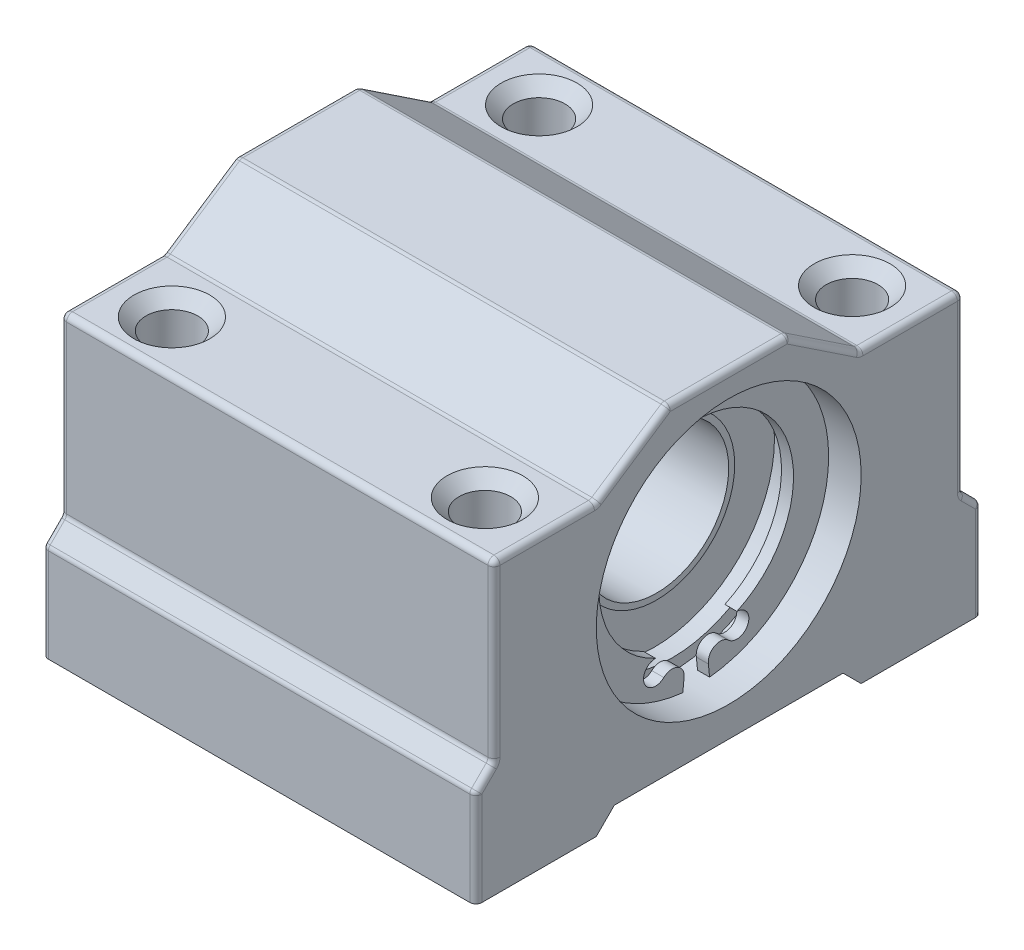
from build123d import *

# Parameters (mm, degrees)
SKETCH1_R           = 11
BOSS_EXTRUDE1_DEPTH = 36
EXTRUDE_THIN1_START = 0.5
SKETCH1_4_R         = 6.5
SKETCH1_4_R_2       = 6
EXTRUDE_THIN1_DEPTH = 29.5
BOSS_EXTRUDE2_START = 0.8
SKETCH1_5_R         = 10
SKETCH1_5_R_2       = 6
BOSS_EXTRUDE2_DEPTH = 29
BOSS_EXTRUDE3_START = 0.3
SKETCH1_6_R         = 11
SKETCH1_6_R_2       = 10
BOSS_EXTRUDE3_DEPTH = 31
BOSS_EXTRUDE4_START = 1
BOSS_EXTRUDE4_DEPTH = 1
FILLET1_R           = 0.5
SKETCH4_R           = 2.15
CUT_EXTRUDE3_DEPTH  = 51.209560914
CHAMFER1_SIZE       = 1


with BuildPart() as part:
    # Sketch1 → Boss-Extrude1 (new body)
    with BuildSketch(Plane(origin=(0, 0, 0), x_dir=(0, 0, -1), z_dir=(1, 0, 0))):
        Polygon((-21, -15), (-11, -15), (-9.5, -13.5), (9.5, -13.5), (11, -15), (21, -15), (21, -7), (19.5, -5.5), (19.5, 9), (11, 9), (5, 13), (-5, 13), (-11, 9), (-19.5, 9), (-19.5, -5.5), (-21, -7), align=None)
        Circle(SKETCH1_R, mode=Mode.SUBTRACT)
    extrude(amount=BOSS_EXTRUDE1_DEPTH)



with BuildPart() as body_2:
    # Sketch1<4> → Extrude-Thin1 (new body)
    with BuildSketch(Plane(origin=(0, 0, 0), x_dir=(0, 0, -1), z_dir=(1, 0, 0)).offset(EXTRUDE_THIN1_START)):
        Circle(SKETCH1_4_R)
        Circle(SKETCH1_4_R_2, mode=Mode.SUBTRACT)
    extrude(amount=EXTRUDE_THIN1_DEPTH)

    # Sketch1<5> → Boss-Extrude2 (add)
    with BuildSketch(Plane(origin=(0, 0, 0), x_dir=(0, 0, -1), z_dir=(1, 0, 0)).offset(BOSS_EXTRUDE2_START)):
        Circle(SKETCH1_5_R)
        Circle(SKETCH1_5_R_2, mode=Mode.SUBTRACT)
    extrude(amount=BOSS_EXTRUDE2_DEPTH)


with BuildPart() as part_1:
    add(part.part)

    add(body_2.part)  # Boss-Extrude3 merges body 2
    # Sketch1<6> → Boss-Extrude3 (add)
    with BuildSketch(Plane(origin=(0, 0, 0), x_dir=(0, 0, -1), z_dir=(1, 0, 0)).offset(BOSS_EXTRUDE3_START)):
        Circle(SKETCH1_6_R)
        Circle(SKETCH1_6_R_2, mode=Mode.SUBTRACT)
    extrude(amount=BOSS_EXTRUDE3_DEPTH)

    # Sketch3 → Boss-Extrude4 (add)
    with BuildSketch(Plane(origin=(31.3, 0, 0), x_dir=(0, 0, -1), z_dir=(1, 0, 0)).offset(BOSS_EXTRUDE4_START)):
        with BuildLine():
            Line((-1.011429614, -9.94871902), (-1.112572576, -10.943590922))
            ThreePointArc((-1.112572576, -10.943590922), (0, 11), (1.112572576, -10.943590922))
            Line((1.112572576, -10.943590922), (1.011429614, -9.94871902))
            ThreePointArc((1.011429614, -9.94871902), (1.535872296, -8.912190675), (2.686623353, -9.070945649))
            ThreePointArc((2.686623353, -9.070945649), (4.301522401, -8.715825098), (3.378506843, -7.343946161))
            ThreePointArc((3.378506843, -7.343946161), (0, 8.083801933), (-3.378506843, -7.343946161))
            ThreePointArc((-3.378506843, -7.343946161), (-4.301522401, -8.715825098), (-2.686623353, -9.070945649))
            ThreePointArc((-2.686623353, -9.070945649), (-1.535872296, -8.912190675), (-1.011429614, -9.94871902))
        make_face()
    extrude(amount=BOSS_EXTRUDE4_DEPTH)

    # Fillet1
    fillet1_edges = [part_1.edges().sort_by_distance(p)[0] for p in [
        (18, -5.5, -19.5),
        (18, -5.5, 19.5),
        (18, -7, 21),
        (18, -7, -21),
        (18, 9, -11),
        (18, 9, 11),
        (18, 13, 5),
        (18, 13, -5),
        (18, 9, -19.5),
        (18, 9, 19.5),
        (36, 11, -8),
        (36, 11, 8),
        (36, 1.75, 19.5),
        (0, -6.25, 20.25),
        (0, 11, 8),
        (36, -6.25, -20.25),
        (36, -11, -21),
        (36, 1.75, -19.5),
        (36, 13, 0),
        (36, 9, -15.25),
        (36, 9, 15.25),
        (36, -6.25, 20.25),
        (36, -11, 21),
        (0, -11, -21),
        (0, -6.25, -20.25),
        (0, 1.75, -19.5),
        (0, 11, -8),
        (0, 9, -15.25),
        (0, 13, 0),
        (0, -11, 21),
        (0, 1.75, 19.5),
        (0, 9, 15.25),
    ]]
    fillet(fillet1_edges, radius=FILLET1_R)

    # Sketch4 → Cut-Extrude3 (cut, through all)
    with BuildSketch(Plane.XZ.offset(15)):
        with Locations((5, 15.25)):
            Circle(SKETCH4_R)
        with Locations((31, 15.25)):
            Circle(SKETCH4_R)
        with Locations((31, -15.25)):
            Circle(SKETCH4_R)
        with Locations((5, -15.25)):
            Circle(SKETCH4_R)
    extrude(amount=-CUT_EXTRUDE3_DEPTH, mode=Mode.SUBTRACT)

    # Chamfer1
    chamfer1_edges = [part_1.edges().sort_by_distance(p)[0] for p in [
        (28.85, 9, -15.25),
        (2.85, 9, -15.25),
        (2.85, 9, 15.25),
        (28.85, 9, 15.25),
        (28.85, -15, 15.25),
        (2.85, -15, 15.25),
    ]]
    chamfer(chamfer1_edges, length=CHAMFER1_SIZE)


solid = part_1.part
